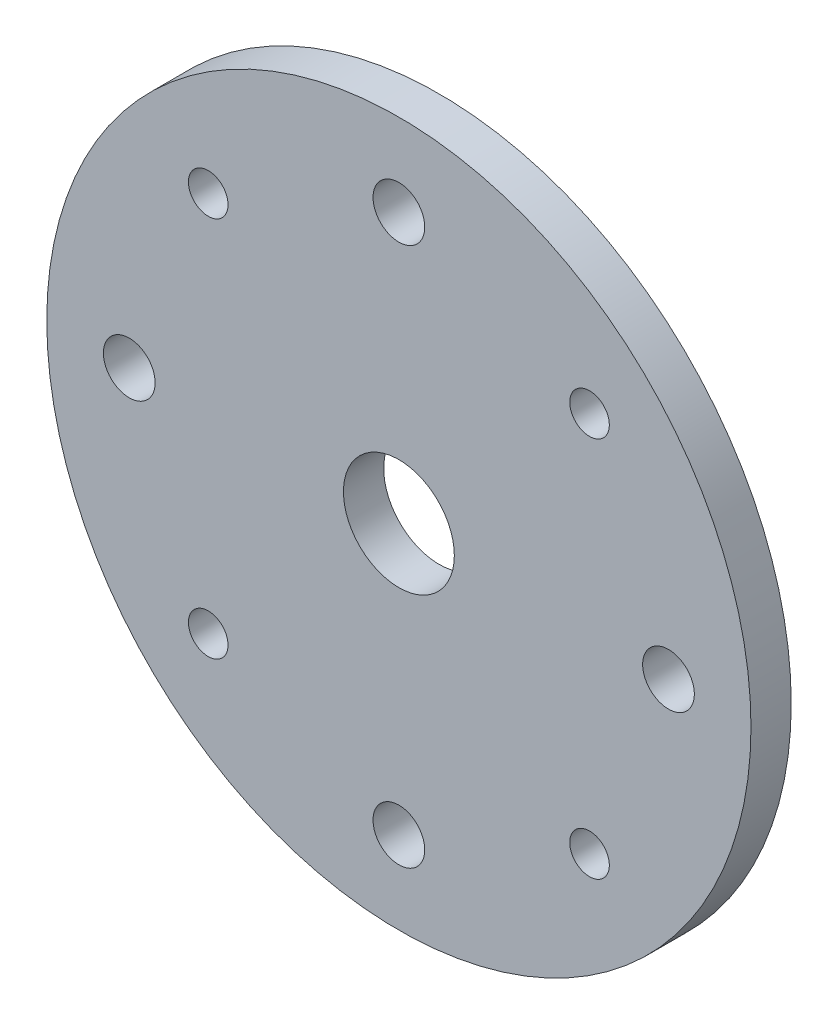
from build123d import *

# Parameters (mm, degrees)
SKETCH1_R           = 44.45
SKETCH1_R_2         = 6.9999987
SKETCH1_R_3         = 3.2639
SKETCH1_R_4         = 2.5
BOSS_EXTRUDE1_DEPTH = 5.08


with BuildPart() as part:
    # Sketch1 → Boss-Extrude1 (new body)
    with BuildSketch(Plane.XY):
        Circle(SKETCH1_R)
        Circle(SKETCH1_R_2, mode=Mode.SUBTRACT)
        with Locations((0, 34.036)):
            Circle(SKETCH1_R_3, mode=Mode.SUBTRACT)
        with Locations((34.036, 0)):
            Circle(SKETCH1_R_3, mode=Mode.SUBTRACT)
        with Locations((0, -34.036)):
            Circle(SKETCH1_R_3, mode=Mode.SUBTRACT)
        with Locations((-34.036, 0)):
            Circle(SKETCH1_R_3, mode=Mode.SUBTRACT)
        with Locations((24.067086404, 24.067086404)):
            Circle(SKETCH1_R_4, mode=Mode.SUBTRACT)
        with Locations((24.067086404, -24.067086404)):
            Circle(SKETCH1_R_4, mode=Mode.SUBTRACT)
        with Locations((-24.067086404, -24.067086404)):
            Circle(SKETCH1_R_4, mode=Mode.SUBTRACT)
        with Locations((-24.067086404, 24.067086404)):
            Circle(SKETCH1_R_4, mode=Mode.SUBTRACT)
    extrude(amount=BOSS_EXTRUDE1_DEPTH)


solid = part.part
